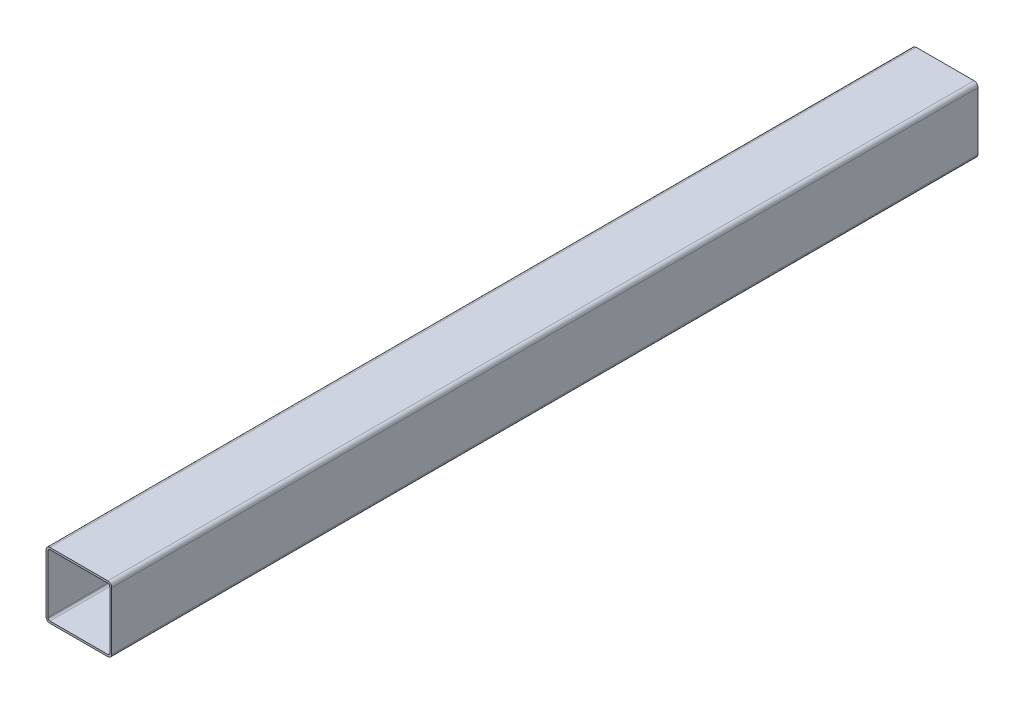
from build123d import *

# Parameters (mm, degrees)
BOSS_EXTRUDE1_DEPTH = 1318


with BuildPart() as part:
    # Sketch1 → Boss-Extrude1 (new body)
    with BuildSketch(Plane.XY):
        with BuildLine():
            Line((6, 0), (94, 0))
            ThreePointArc((94, 0), (98.242640687, 1.757359313), (100, 6))
            Line((100, 6), (100, 94))
            ThreePointArc((100, 94), (98.242640687, 98.242640687), (94, 100))
            Line((94, 100), (6, 100))
            ThreePointArc((6, 100), (1.757359313, 98.242640687), (0, 94))
            Line((0, 94), (0, 6))
            ThreePointArc((0, 6), (1.757359313, 1.757359313), (6, 0))
        make_face()
        with BuildLine():
            Line((3, 6), (3, 94))
            ThreePointArc((3, 94), (3.878679656, 96.121320344), (6, 97))
            Line((6, 97), (94, 97))
            ThreePointArc((94, 97), (96.121320344, 96.121320344), (97, 94))
            Line((97, 94), (97, 6))
            ThreePointArc((97, 6), (96.121320344, 3.878679656), (94, 3))
            Line((94, 3), (6, 3))
            ThreePointArc((6, 3), (3.878679656, 3.878679656), (3, 6))
        make_face(mode=Mode.SUBTRACT)
    extrude(amount=BOSS_EXTRUDE1_DEPTH)


solid = part.part
